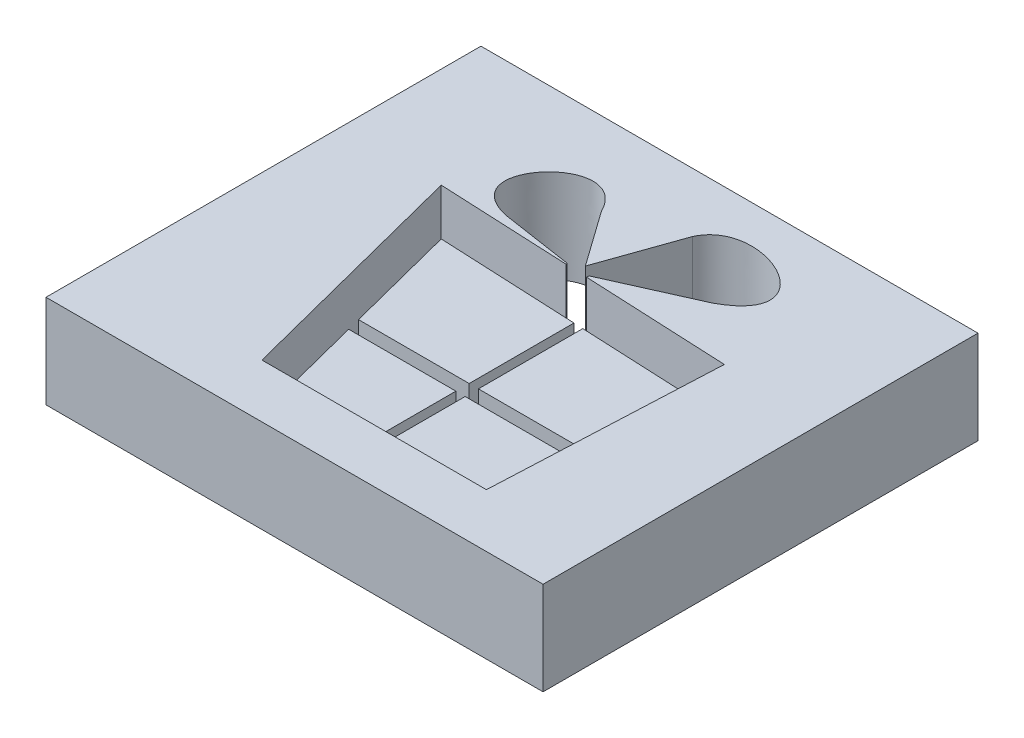
from build123d import *

# Parameters (mm, degrees)
SKETCH1_W           = 16
SKETCH1_H           = 14
BOSS_EXTRUDE1_DEPTH = 3
CUT_EXTRUDE5_DEPTH  = 3
CUT_EXTRUDE6_DEPTH  = 1.5


with BuildPart() as part:
    # Sketch1 → Boss-Extrude1 (new body)
    with BuildSketch(Plane(origin=(0, 0, 0), x_dir=(1, 0, 0), z_dir=(0, 1, 0))):
        with Locations((-34.802547771, 15.318471338)):
            Rectangle(SKETCH1_W, SKETCH1_H)
    extrude(amount=BOSS_EXTRUDE1_DEPTH)

    # Sketch2 → Cut-Extrude5 (cut)
    with BuildSketch(Plane(origin=(0, 3, 0), x_dir=(1, 0, 0), z_dir=(0, 1, 0))):
        with BuildLine():
            Line((-35.361772538, 17.654157516), (-35.361772538, 17.610701513))
            Line((-35.361772538, 17.610701513), (-35.087707093, 17.598006383))
            Line((-35.087707093, 17.598006383), (-35.087707093, 14.224865562))
            Line((-35.087707093, 14.224865562), (-38.648703672, 14.224865562))
            Line((-38.648703672, 14.224865562), (-38.539082436, 13.797679772))
            Line((-38.539082436, 13.797679772), (-35.088327204, 13.797679772))
            Line((-35.088327204, 13.797679772), (-35.088327204, 10.043136726))
            Line((-35.088327204, 10.043136726), (-34.789528654, 10.043136726))
            Line((-34.789528654, 10.043136726), (-34.789528654, 13.797679772))
            Line((-34.789528654, 13.797679772), (-30.176657964, 13.797679772))
            Line((-30.176657964, 13.797679772), (-30.156870066, 14.224865562))
            Line((-30.156870066, 14.224865562), (-34.789528654, 14.224865562))
            Line((-34.789528654, 14.224865562), (-34.789528654, 17.584194303))
            Line((-34.789528654, 17.584194303), (-34.658050894, 17.578104053))
            Line((-34.658050894, 17.578104053), (-34.658050894, 17.654157516))
            Line((-34.658050894, 17.654157516), (-31.911401586, 18.883435151))
            add(Edge.make_bspline(
                [(-31.911401586, 18.883435151), (-29.374274196, 20.248494332), (-33.305897718, 22.135276734), (-34.090701751, 20.417941358)],
                knots=[0, 0, 0, 0, 1, 1, 1, 1], degree=3))
            Line((-34.090701751, 20.417941358), (-34.991899262, 17.868989737))
            Line((-34.991899262, 17.868989737), (-36.257619528, 19.650233345))
            add(Edge.make_bspline(
                [(-36.257619528, 19.650233345), (-37.304461787, 21.759932149), (-40.155684718, 18.540444353), (-37.66921168, 18.003375835)],
                knots=[0, 0, 0, 0, 1, 1, 1, 1], degree=3))
            Line((-37.66921168, 18.003375835), (-35.361772538, 17.654157516))
        make_face()
    extrude(amount=-CUT_EXTRUDE5_DEPTH, mode=Mode.SUBTRACT)

    # Sketch3 → Cut-Extrude6 (cut)
    with BuildSketch(Plane(origin=(0, 3, 0), x_dir=(1, 0, 0), z_dir=(0, 1, 0))):
        Polygon((-35.087707093, 17.598006383), (-39.567544365, 17.805519282), (-37.575619559, 10.043136726), (-30.350574127, 10.043136726), (-30.011512943, 17.362869325), align=None)
    extrude(amount=-CUT_EXTRUDE6_DEPTH, mode=Mode.SUBTRACT)


solid = part.part
